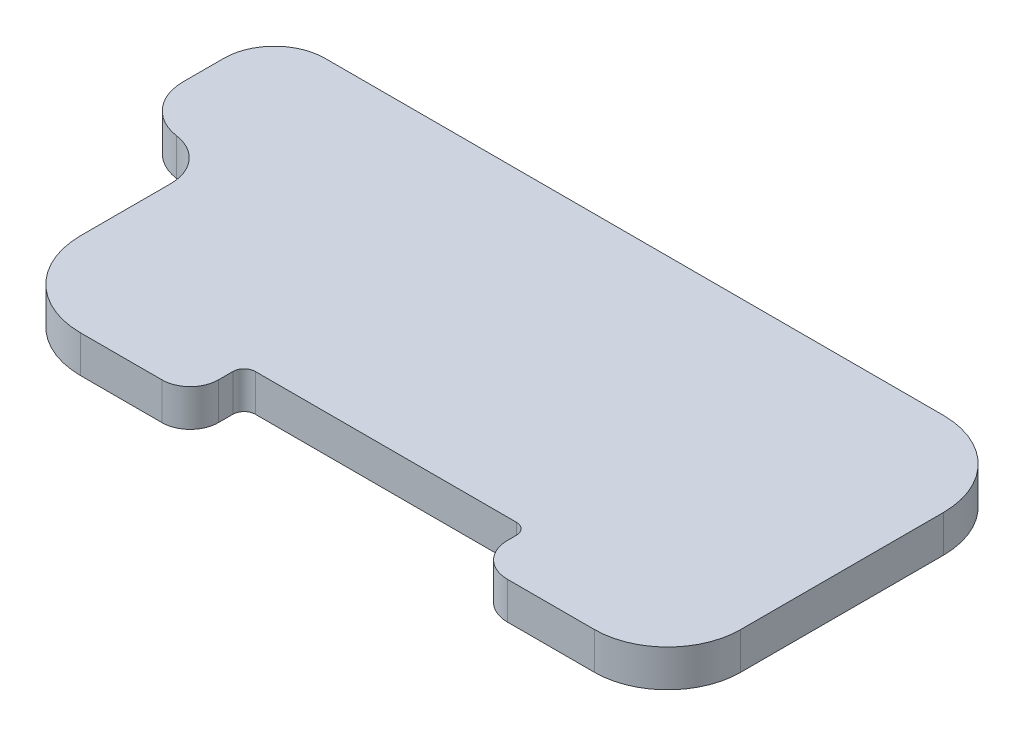
from build123d import *
from OCP.BRepFilletAPI import BRepFilletAPI_MakeFillet

# Parameters (mm, degrees)
BOSS_EXTRUDE1_DEPTH = 1.32
FILLET1_R           = 3
FILLET2_R           = 2.6
FILLET3_R1          = 1.2
FILLET3_R2          = 1
FILLET4_R           = 0.4
FILLET5_R           = 1.8
FILLET6_R           = 1.6


with BuildPart() as part:
    # Sketch1 → Boss-Extrude1 (new body)
    with BuildSketch(Plane(origin=(0, 0, 0), x_dir=(1, 0, 0), z_dir=(0, 1, 0))):
        Polygon((0, 0), (2.92, 0), (2.92, -7.77), (9.82, -7.77), (9.82, -5.85), (19.92, -5.85), (19.92, -7.77), (26.82, -7.77), (26.82, 5.05), (0, 5.05), align=None)
    extrude(amount=BOSS_EXTRUDE1_DEPTH)

    # Fillet1
    fillet1_edges = [part.edges().sort_by_distance(p)[0] for p in [
        (2.92, 0.66, 7.77),
        (26.82, 0.66, -5.05),
    ]]
    fillet(fillet1_edges, radius=FILLET1_R)

    # Fillet2
    fillet2_edges = [part.edges().sort_by_distance(p)[0] for p in [
        (26.82, 0.66, 7.77),
    ]]
    fillet(fillet2_edges, radius=FILLET2_R)

    # Fillet3: one fillet with a radius per group of edges: ONE call of the kernel's fillet builder (fillet() takes one radius for all edges)
    fillet3_edges_1 = [part.edges().sort_by_distance(p)[0] for p in [
        (19.92, 0.66, 7.77),
    ]]
    fillet3_edges_2 = [part.edges().sort_by_distance(p)[0] for p in [
        (9.82, 0.66, 7.77),
    ]]
    fillet3 = BRepFilletAPI_MakeFillet(part.part.solid().wrapped)
    for e in fillet3_edges_1:
        fillet3.Add(FILLET3_R1, e.wrapped)
    for e in fillet3_edges_2:
        fillet3.Add(FILLET3_R2, e.wrapped)
    add(Compound.cast(fillet3.Shape()), mode=Mode.REPLACE)

    # Fillet4
    fillet4_edges = [part.edges().sort_by_distance(p)[0] for p in [
        (9.82, 0.66, 5.85),
        (19.92, 0.66, 5.85),
    ]]
    fillet(fillet4_edges, radius=FILLET4_R)

    # Fillet5
    fillet5_edges = [part.edges().sort_by_distance(p)[0] for p in [
        (0, 0.66, -5.05),
        (0, 0.66, 0),
    ]]
    fillet(fillet5_edges, radius=FILLET5_R)

    # Fillet6
    fillet6_edges = [part.edges().sort_by_distance(p)[0] for p in [
        (2.92, 0.66, 0),
    ]]
    fillet(fillet6_edges, radius=FILLET6_R)


solid = part.part
